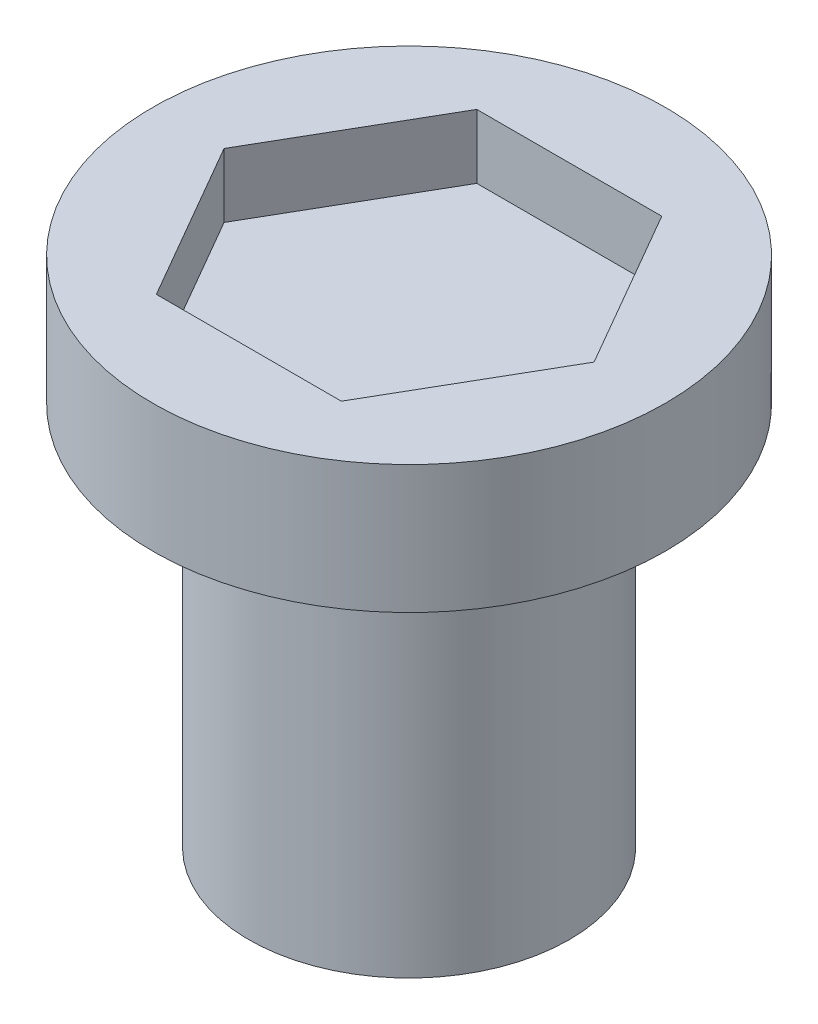
from build123d import *

# Parameters (mm, degrees)
CUT_EXTRUDE_1_DEPTH = 0.5


with BuildPart() as part:
    # Эскиз1 → Повернуть1 (revolve)
    with BuildSketch(Plane.XY):
        Polygon((0, 0), (1.25, 0), (1.25, 3), (2, 3), (2, 4), (0, 4), align=None)
    revolve(axis=Axis((0, 4, 0), (0, 1, 0)))

    # Эскиз2 → Вырез-Вытянуть1 (cut)
    with BuildSketch(Plane(origin=(0, 4, 0), x_dir=(1, 0, 0), z_dir=(0, 1, 0))):
        Polygon((1.443375673, 0), (0.721687836, 1.25), (-0.721687836, 1.25), (-1.443375673, 0), (-0.721687836, -1.25), (0.721687836, -1.25), align=None)
    extrude(amount=-CUT_EXTRUDE_1_DEPTH, mode=Mode.SUBTRACT)


solid = part.part
